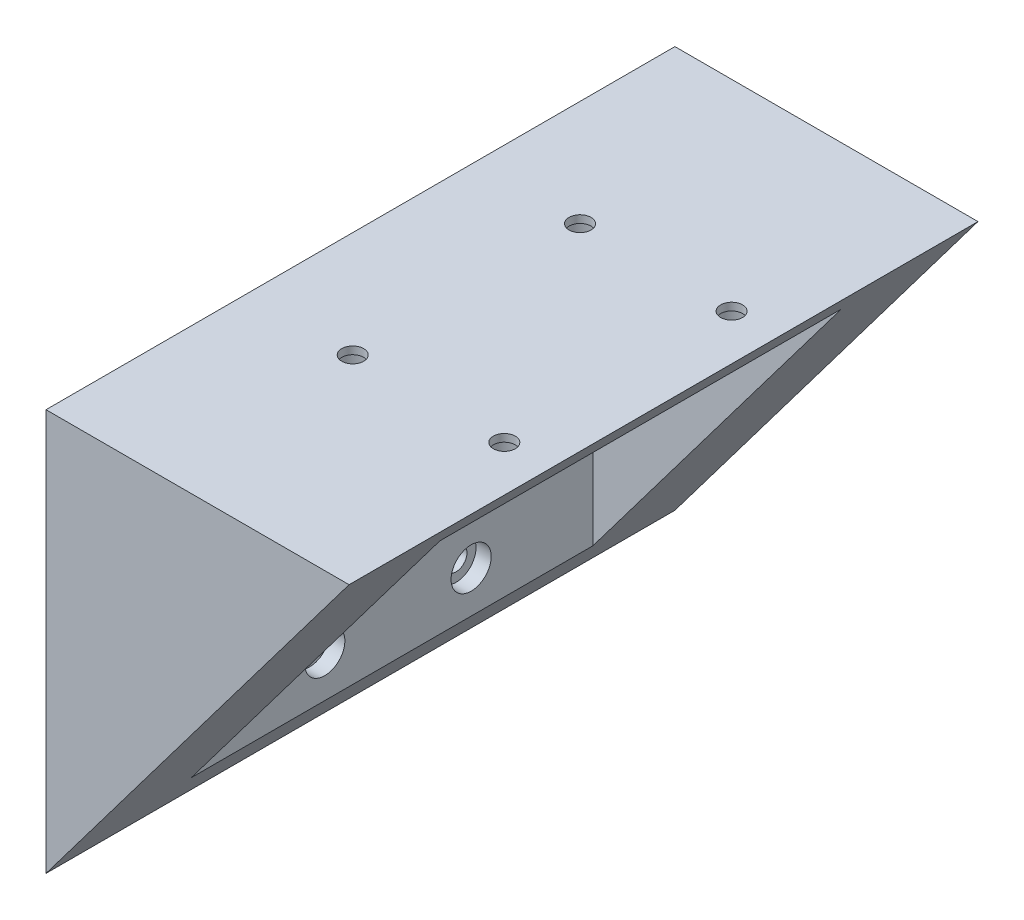
from build123d import *

# Parameters (mm, degrees)
EXTRUDE_1_DEPTH     = 83
CUT_EXTRUDE_1_DEPTH = 26.5
SKETCH_4_R          = 1.45
CUT_EXTRUDE_3_DEPTH = 10
SKETCH_5_R          = 1.45
CUT_EXTRUDE_4_DEPTH = 10
SKETCH_6_R          = 2.65
CUT_EXTRUDE_5_DEPTH = 2
SKETCH_7_R          = 2.8
CUT_EXTRUDE_6_DEPTH = 3


with BuildPart() as part:
    # 草图1 → 凸台-拉伸1 (new body)
    with BuildSketch(Plane.XY):
        Polygon((0, 2.333144796), (0, -50.666855204), (40, 2.333144796), align=None)
    extrude(amount=EXTRUDE_1_DEPTH)

    # 草图3 → 切除-拉伸1 (cut, symmetric)
    with BuildSketch(Plane.XY.offset(41.5)):
        Polygon((36.981132075, -1.666855204), (4.173584906, -1.666855204), (4.173584906, -45.136855204), align=None)
    extrude(amount=CUT_EXTRUDE_1_DEPTH, both=True, mode=Mode.SUBTRACT)

    # 草图4 → 切除-拉伸3 (cut)
    with BuildSketch(Plane(origin=(4.173584906, 0, 0), x_dir=(0, 0, -1), z_dir=(1, 0, 0))):
        with Locations(Location((-31.068580938, -39.636855204, 0), (0, 0, 90))):
            Circle(SKETCH_4_R)
        with Locations(Location((-31.068580938, -28.686855204, 0), (0, 0, 90))):
            Circle(SKETCH_4_R)
        with Locations(Location((-50.38, -28.686855204, 0), (0, 0, 90))):
            Circle(SKETCH_4_R)
        with Locations(Location((-50.38, -39.636855204, 0), (0, 0, 90))):
            Circle(SKETCH_4_R)
    extrude(amount=-CUT_EXTRUDE_3_DEPTH, mode=Mode.SUBTRACT)

    # 草图5 → 切除-拉伸4 (cut)
    with BuildSketch(Plane.XZ.offset(1.666855204)):
        with Locations((13.981132075, 56.5)):
            Circle(SKETCH_5_R)
        with Locations((33.981132075, 56.5)):
            Circle(SKETCH_5_R)
        with Locations((13.981132075, 26.5)):
            Circle(SKETCH_5_R)
        with Locations((33.981132075, 26.5)):
            Circle(SKETCH_5_R)
    extrude(amount=-CUT_EXTRUDE_4_DEPTH, mode=Mode.SUBTRACT)

    # 草图6 → 切除-拉伸5 (cut)
    with BuildSketch(Plane(origin=(4.173584906, 0, 0), x_dir=(0, 0, -1), z_dir=(1, 0, 0))):
        with Locations(Location((-50.38, -28.686855204, 0), (0, 0, 90))):
            Circle(SKETCH_6_R)
        with Locations(Location((-31.068580938, -28.686855204, 0), (0, 0, 90))):
            Circle(SKETCH_6_R)
        with Locations(Location((-50.38, -39.636855204, 0), (0, 0, 90))):
            Circle(SKETCH_6_R)
        with Locations(Location((-31.068580938, -39.636855204, 0), (0, 0, 90))):
            Circle(SKETCH_6_R)
    extrude(amount=-CUT_EXTRUDE_5_DEPTH, mode=Mode.SUBTRACT)

    # 草图7 → 切除-拉伸6 (cut)
    with BuildSketch(Plane.XZ.offset(1.666855204)):
        with Locations((13.981132075, 56.5)):
            Circle(SKETCH_7_R)
        with Locations((33.981132075, 56.5)):
            Circle(SKETCH_7_R)
        with Locations((13.981132075, 26.5)):
            Circle(SKETCH_7_R)
        with Locations((33.981132075, 26.5)):
            Circle(SKETCH_7_R)
    extrude(amount=-CUT_EXTRUDE_6_DEPTH, mode=Mode.SUBTRACT)


solid = part.part
